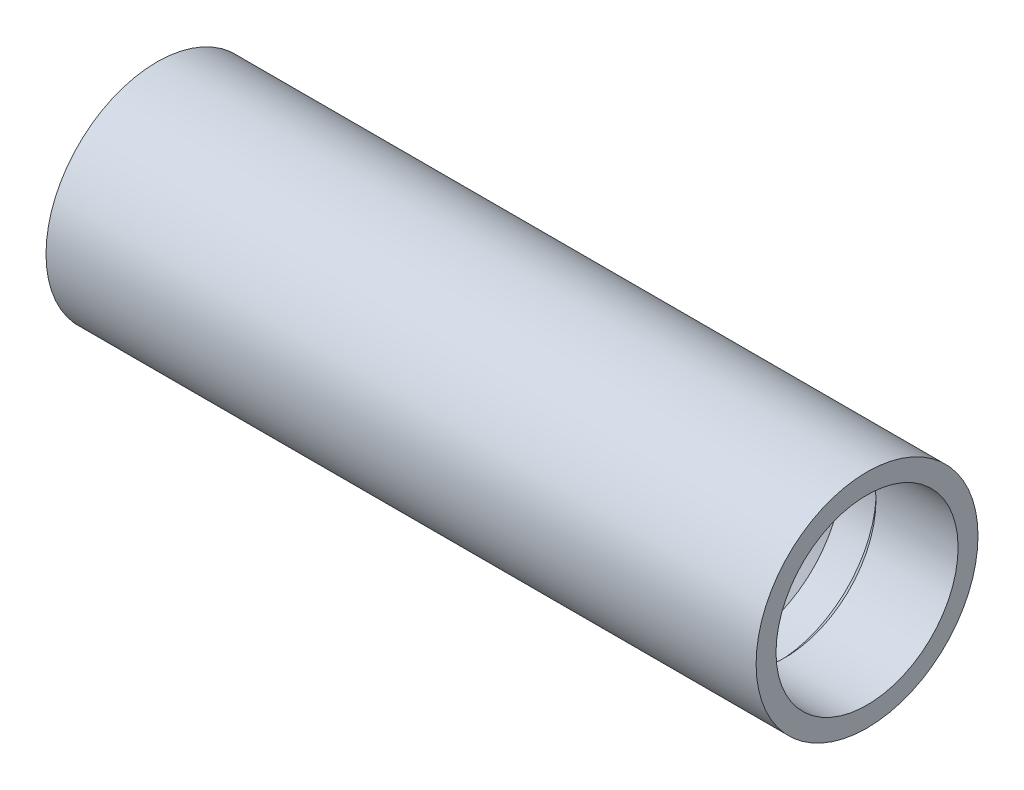
from build123d import *

# Parameters (mm, degrees)
SKETCH1_R           = 5.55625
SKETCH1_R_2         = 4.5593
BOSS_EXTRUDE1_DEPTH = 35.56


with BuildPart() as part:
    # Sketch1 → Boss-Extrude1 (new body)
    with BuildSketch(Plane(origin=(0, 0, 0), x_dir=(0, 0, -1), z_dir=(1, 0, 0))):
        Circle(SKETCH1_R)
        Circle(SKETCH1_R_2, mode=Mode.SUBTRACT)
    extrude(amount=BOSS_EXTRUDE1_DEPTH)

    # Sketch2 → Cut-Revolve1 (revolve, cut)
    with BuildSketch(Plane.XY, mode=Mode.PRIVATE) as cut_revolve1_sk:
        Polygon((17.570232791, -4.445), (20.033534416, -4.445), (19.583193844, -4.976009125), (18.020573363, -4.976009125), align=None)
        Polygon((28.774465682, -4.445), (31.559150182, -4.445), (31.020477762, -5.004932574), (29.313138102, -5.004932574), align=None)
        Polygon((4.182688786, -4.445), (7.557077958, -4.445), (7.106737387, -5.18020875), (4.633029357, -5.18020875), align=None)
    revolve(cut_revolve1_sk.sketch.rotate(Axis((0, 0, 0), (1, 0, 0)), 270), axis=Axis((0, 0, 0), (1, 0, 0)), mode=Mode.SUBTRACT)


solid = part.part
